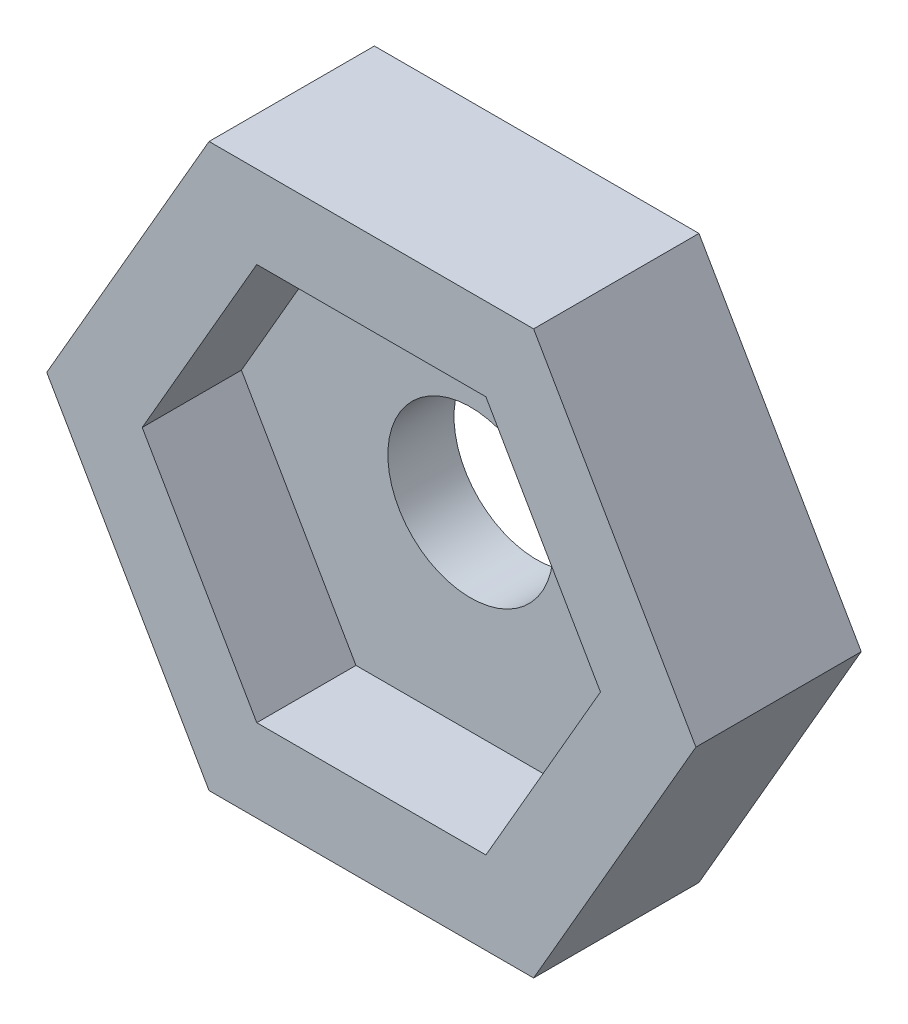
from build123d import *

# Parameters (mm, degrees)
SKETCH1_R           = 2.5
BOSS_EXTRUDE1_DEPTH = 5
CUT_EXTRUDE1_DEPTH  = 3


with BuildPart() as part:
    # Sketch1 → Boss-Extrude1 (new body)
    with BuildSketch(Plane.XY):
        Polygon((-9.814954576, 0), (-4.907477288, -8.5), (4.907477288, -8.5), (9.814954576, 0), (4.907477288, 8.5), (-4.907477288, 8.5), align=None)
        Circle(SKETCH1_R, mode=Mode.SUBTRACT)
    extrude(amount=BOSS_EXTRUDE1_DEPTH)

    # Sketch2 → Cut-Extrude1 (cut)
    with BuildSketch(Plane.XY.offset(5)):
        Polygon((3.464101615, -6), (6.92820323, 0), (3.464101615, 6), (-3.464101615, 6), (-6.92820323, 0), (-3.464101615, -6), align=None)
    extrude(amount=-CUT_EXTRUDE1_DEPTH, mode=Mode.SUBTRACT)


solid = part.part
